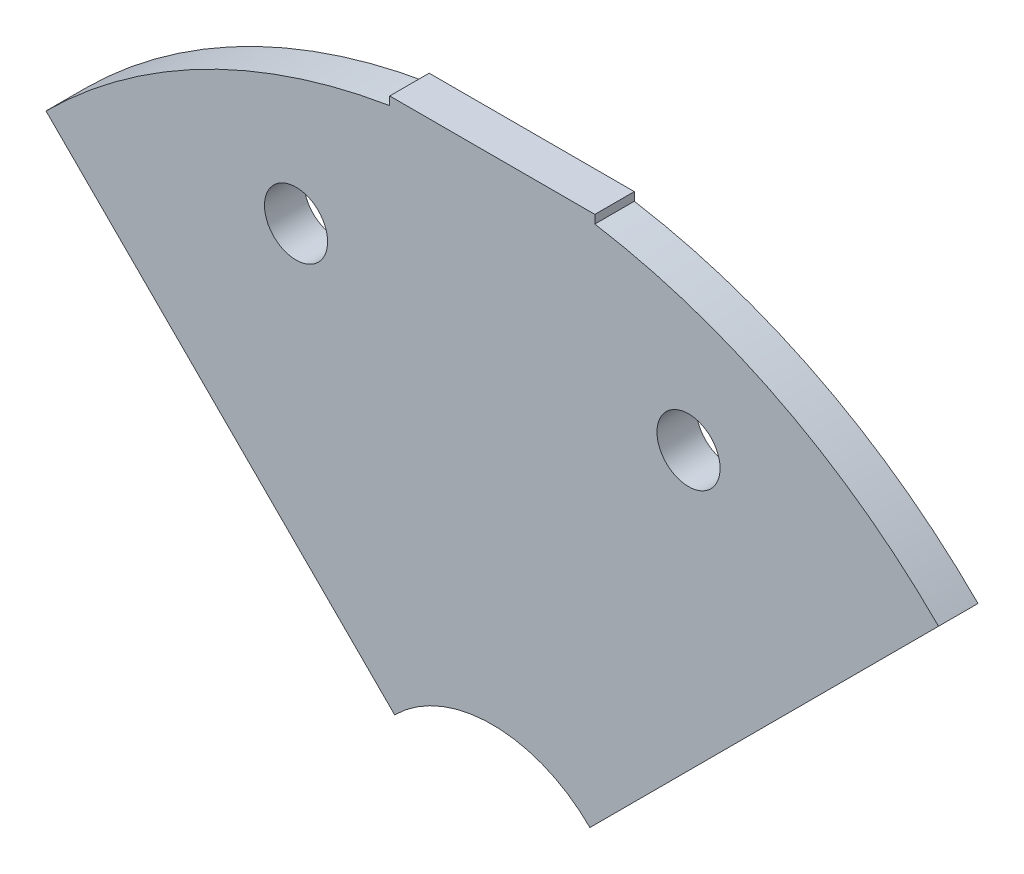
from build123d import *

# Parameters (mm, degrees)
SKETCH1_R           = 4
BOSS_EXTRUDE1_DEPTH = 5
CUT_EXTRUDE1_DEPTH  = 114.247516529
SKETCH3_W           = 26
SKETCH3_H           = 1.063316513
BOSS_EXTRUDE2_DEPTH = 5


with BuildPart() as part:
    # Sketch1 → Boss-Extrude1 (new body)
    with BuildSketch(Plane.XY):
        with BuildLine():
            Line((-80, 0), (-17.5, 0))
            ThreePointArc((-17.5, 0), (0, 17.5), (17.5, 0))
            Line((17.5, 0), (80, 0))
            ThreePointArc((80, 0), (0, 80), (-80, 0))
        make_face()
        with Locations((24.874423104, 60.052169613)):
            Circle(SKETCH1_R, mode=Mode.SUBTRACT)
        with Locations((60.052169613, 24.874423104)):
            Circle(SKETCH1_R, mode=Mode.SUBTRACT)
        with Locations((-60.052169613, 24.874423104)):
            Circle(SKETCH1_R, mode=Mode.SUBTRACT)
        with Locations(Location((-24.874423104, 60.052169613, 0), (0, 0, 180))):
            Circle(SKETCH1_R, mode=Mode.SUBTRACT)
    extrude(amount=BOSS_EXTRUDE1_DEPTH)

    # Sketch2 → Cut-Extrude1 (cut, through all)
    with BuildSketch(Plane.XY):
        with BuildLine():
            Line((-12.374368671, 12.374368671), (-56.568542495, 56.568542495))
            Line((-56.568542495, 56.568542495), (-80, 56.568542495))
            Line((-80, 56.568542495), (-80, 0))
            Line((-80, 0), (-17.5, 0))
            ThreePointArc((-17.5, 0), (-16.167891819, 6.696960066), (-12.374368671, 12.374368671))
        make_face()
        with BuildLine():
            Line((80, 0), (80, 56.568542495))
            Line((80, 56.568542495), (56.568542495, 56.568542495))
            Line((56.568542495, 56.568542495), (12.374368671, 12.374368671))
            ThreePointArc((12.374368671, 12.374368671), (16.167891819, 6.696960066), (17.5, 0))
            Line((17.5, 0), (80, 0))
        make_face()
    extrude(amount=CUT_EXTRUDE1_DEPTH, mode=Mode.SUBTRACT)

    # Sketch3 → Boss-Extrude2 (add)
    with BuildSketch(Plane.XY):
        with Locations((0, 79.468341744)):
            Rectangle(SKETCH3_W, SKETCH3_H)
    extrude(amount=BOSS_EXTRUDE2_DEPTH)


solid = part.part
